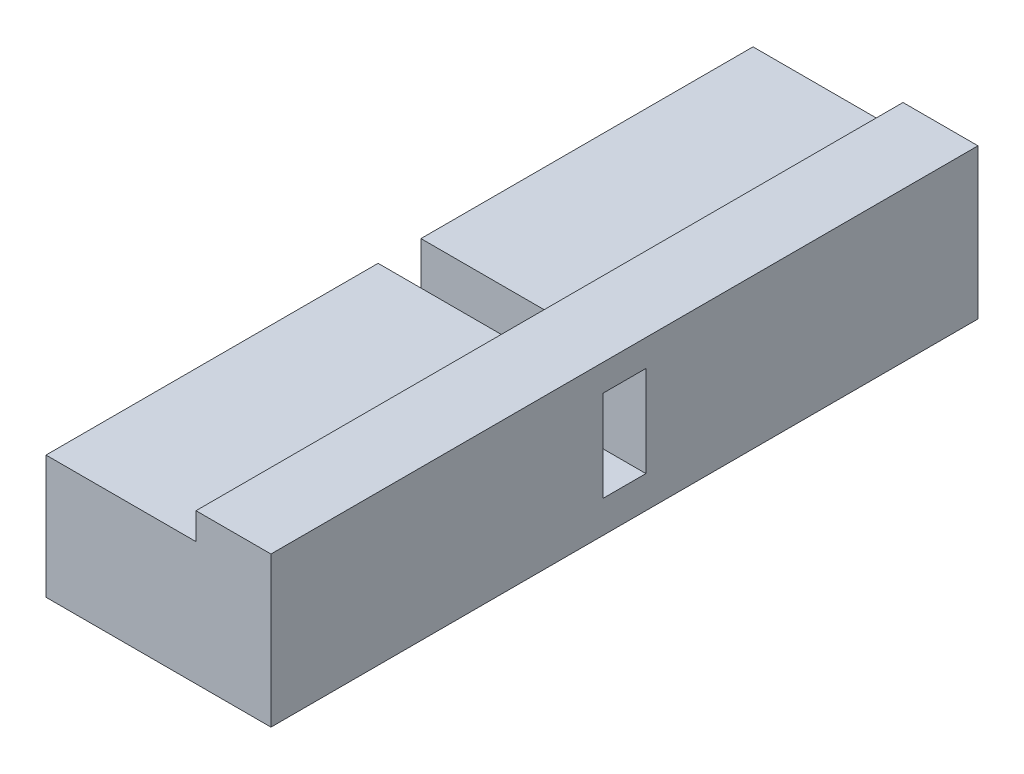
from build123d import *

# Parameters (mm, degrees)
SK_P01_CARRIER_W             = 21
SK_P01_CARRIER_H             = 66
P01_CARRIER_DEPTH            = 3
P02_WAGO221415GNDSTAR_START  = 3
SK_P02_WAGO221415GNDSTAR_W   = 21
SK_P02_WAGO221415GNDSTAR_H   = 31
P02_WAGO221415GNDSTAR_DEPTH  = 8.5
P03_WAGO221415PACKNODE_START = 3
SK_P03_WAGO221415PACKNODE_W  = 21
SK_P03_WAGO221415PACKNODE_H  = 31
P03_WAGO221415PACKNODE_DEPTH = 8.5
P04_LEVERS_START             = 11.5
SK_P04_LEVERS_W              = 7
SK_P04_LEVERS_H              = 66
P04_LEVERS_DEPTH             = 2.5


with BuildPart() as part:
    # SK_P01_Carrier → P01_Carrier (new body)
    with BuildSketch(Plane(origin=(0, 0, 0), x_dir=(1, 0, 0), z_dir=(0, 1, 0))):
        Rectangle(SK_P01_CARRIER_W, SK_P01_CARRIER_H)
    extrude(amount=P01_CARRIER_DEPTH)

    # SK_P02_WAGO221415GNDstar → P02_WAGO221415GNDstar (add)
    with BuildSketch(Plane(origin=(0, 0, 0), x_dir=(1, 0, 0), z_dir=(0, 1, 0)).offset(P02_WAGO221415GNDSTAR_START)):
        with Locations((0, 17.5)):
            Rectangle(SK_P02_WAGO221415GNDSTAR_W, SK_P02_WAGO221415GNDSTAR_H)
    extrude(amount=P02_WAGO221415GNDSTAR_DEPTH)

    # SK_P03_WAGO221415packnode → P03_WAGO221415packnode (add)
    with BuildSketch(Plane(origin=(0, 0, 0), x_dir=(1, 0, 0), z_dir=(0, 1, 0)).offset(P03_WAGO221415PACKNODE_START)):
        with Locations((0, -17.5)):
            Rectangle(SK_P03_WAGO221415PACKNODE_W, SK_P03_WAGO221415PACKNODE_H)
    extrude(amount=P03_WAGO221415PACKNODE_DEPTH)

    # SK_P04_Levers → P04_Levers (add)
    with BuildSketch(Plane(origin=(0, 0, 0), x_dir=(1, 0, 0), z_dir=(0, 1, 0)).offset(P04_LEVERS_START)):
        with Locations((7, 0)):
            Rectangle(SK_P04_LEVERS_W, SK_P04_LEVERS_H)
    extrude(amount=P04_LEVERS_DEPTH)


solid = part.part
